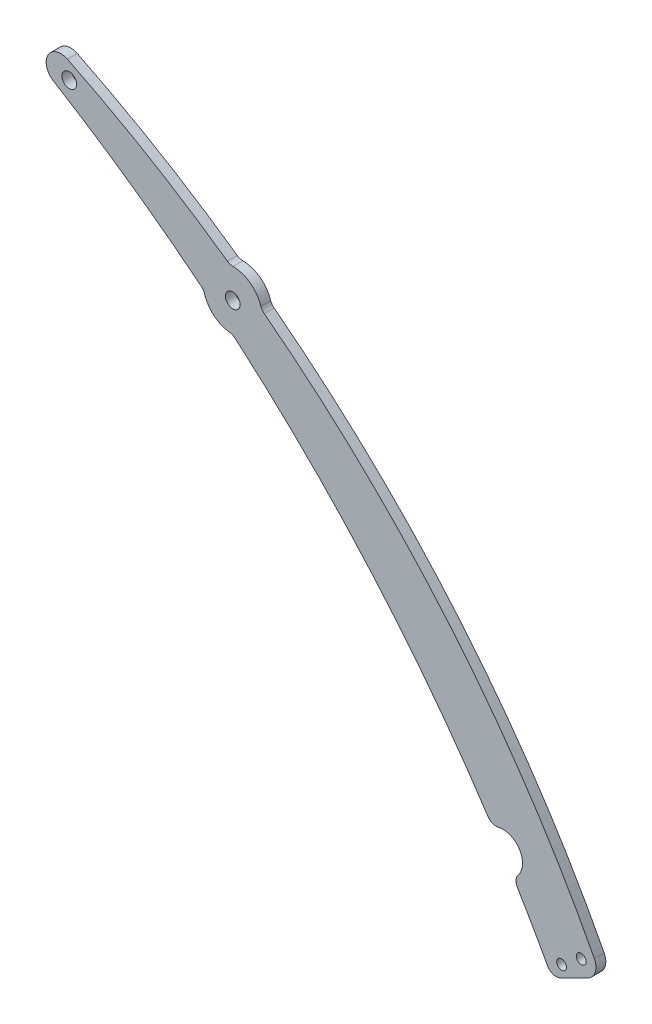
from build123d import *

# Parameters (mm, degrees)
SKETCH_1_R          = 1.5
SKETCH_1_R_2        = 1
EXTRUDE_1_DEPTH     = 2
SCALE_1_SCALE       = 2
SKETCH_3_R          = 1.627142949
SKETCH_3_R_2        = 4.234260579
SKETCH_3_R_3        = 3
EXTRUDE_3_DEPTH     = 4
SKETCH_2_R          = 3
CUT_EXTRUDE_1_DEPTH = 4


with BuildPart() as part:
    # 草图1 → 凸台-拉伸1 (new body)
    with BuildSketch(Plane.XY):
        with BuildLine():
            Line((107.302513423, -106.329977447), (101.737876551, -109.126595767))
            ThreePointArc((101.737876551, -109.126595767), (100.241041238, -109.247857431), (99.081776454, -108.293223729))
            ThreePointArc((99.081776454, -108.293223729), (96.076157143, -102.895430459), (92.952174798, -97.565265927))
            ThreePointArc((92.952174798, -97.565265927), (92.67119221, -96.396525563), (93.110928625, -95.277804356))
            ThreePointArc((93.110928625, -95.277804356), (93.386262354, -90.634283432), (89.082079375, -88.870167754))
            ThreePointArc((89.082079375, -88.870167754), (87.883298953, -88.781676215), (86.951761021, -88.02197737))
            ThreePointArc((86.951761021, -88.02197737), (63.249240179, -56.927091802), (35.446375502, -29.437055089))
            ThreePointArc((35.446375502, -29.437055089), (34.93756912, -29.118601809), (34.357184804, -28.965466337))
            ThreePointArc((34.357184804, -28.965466337), (31.162596189, -27.612410648), (29.250996223, -24.717252331))
            ThreePointArc((29.250996223, -24.717252331), (28.99483955, -24.174407799), (28.589143834, -23.732019493))
            ThreePointArc((28.589143834, -23.732019493), (13.863721442, -12.651321704), (-1.558710581, -2.56328331))
            ThreePointArc((-1.558710581, -2.56328331), (-2.630799159, 1.441837641), (1.322046154, 2.692989782))
            ThreePointArc((1.322046154, 2.692989782), (17.996215952, -6.326789823), (33.906457747, -16.634484455))
            ThreePointArc((33.906457747, -16.634484455), (34.447529327, -16.904338105), (35.04451896, -17.000165164))
            ThreePointArc((35.04451896, -17.000165164), (38.553058948, -18.165150249), (40.712715331, -21.16563811))
            ThreePointArc((40.712715331, -21.16563811), (40.982462328, -21.706762868), (41.401593445, -22.142547854))
            ThreePointArc((41.401593445, -22.142547854), (79.427798672, -58.499548545), (108.618618094, -102.268485529))
            ThreePointArc((108.618618094, -102.268485529), (108.809267395, -104.574248701), (107.302513423, -106.329977447))
        make_face()
        Circle(SKETCH_1_R, mode=Mode.SUBTRACT)
        with Locations((105.955364791, -103.64945687)):
            Circle(SKETCH_1_R_2, mode=Mode.SUBTRACT)
        with Locations((101.955364791, -106.64945687)):
            Circle(SKETCH_1_R_2, mode=Mode.SUBTRACT)
        with Locations((35, -23)):
            Circle(SKETCH_1_R, mode=Mode.SUBTRACT)
    extrude(amount=EXTRUDE_1_DEPTH)


with BuildPart() as part_1:
    # 缩放比例1: scaled about (61.378569751, -51.627856738, 1)
    add(part.part.scale(SCALE_1_SCALE).moved(Location((-61.378569751, 51.627856738, -1))))

    # 草图3 → 凸台-拉伸3 (add)
    # profile 1 of 8: a face of its own
    with BuildSketch(Plane(origin=(0, 0, -1), x_dir=(-1, 0, 0), z_dir=(0, 0, -1))):
        with Locations((58.543077077, 54.655425944)):
            Circle(SKETCH_3_R)
    # profile 2 of 8: a face of its own
    with BuildSketch(Plane(origin=(0, 0, -1), x_dir=(-1, 0, 0), z_dir=(0, 0, -1))):
        with Locations((61.20941419, 50.866420573)):
            Circle(SKETCH_3_R_2)
        with Locations((61.378569751, 51.627856738)):
            Circle(SKETCH_3_R_3, mode=Mode.SUBTRACT)
    # profile 3 of 8: a face of its own
    with BuildSketch(Plane(origin=(0, 0, -1), x_dir=(-1, 0, 0), z_dir=(0, 0, -1))):
        with Locations((58.543077077, 54.655425944)):
            Circle(SKETCH_3_R)
    # profile 4 of 8: a face of its own
    with BuildSketch(Plane(origin=(0, 0, -1), x_dir=(-1, 0, 0), z_dir=(0, 0, -1))):
        with Locations((58.543077077, 54.655425944)):
            Circle(SKETCH_3_R)
    # profile 5 of 8: a face of its own
    with BuildSketch(Plane(origin=(0, 0, -1), x_dir=(-1, 0, 0), z_dir=(0, 0, -1))):
        with Locations((61.20941419, 50.866420573)):
            Circle(SKETCH_3_R_2)
        with Locations((61.378569751, 51.627856738)):
            Circle(SKETCH_3_R_3, mode=Mode.SUBTRACT)
    # profile 6 of 8: a face of its own
    with BuildSketch(Plane(origin=(0, 0, -1), x_dir=(-1, 0, 0), z_dir=(0, 0, -1))):
        with Locations((61.378569751, 51.627856738)):
            Circle(SKETCH_3_R_3)
    # profile 7 of 8: a face of its own
    with BuildSketch(Plane(origin=(0, 0, -1), x_dir=(-1, 0, 0), z_dir=(0, 0, -1))):
        with Locations((58.543077077, 54.655425944)):
            Circle(SKETCH_3_R)
    # profile 8 of 8: a face of its own
    with BuildSketch(Plane(origin=(0, 0, -1), x_dir=(-1, 0, 0), z_dir=(0, 0, -1))):
        with Locations((61.378569751, 51.627856738)):
            Circle(SKETCH_3_R_3)
    extrude(amount=-EXTRUDE_3_DEPTH)

    # 草图2 → 切除-拉伸1 (cut)
    with BuildSketch(Plane.XY.offset(3)):
        with Locations((-57.967630724, 49.966726496)):
            Circle(SKETCH_2_R)
    extrude(amount=-CUT_EXTRUDE_1_DEPTH, mode=Mode.SUBTRACT)


solid = part_1.part
